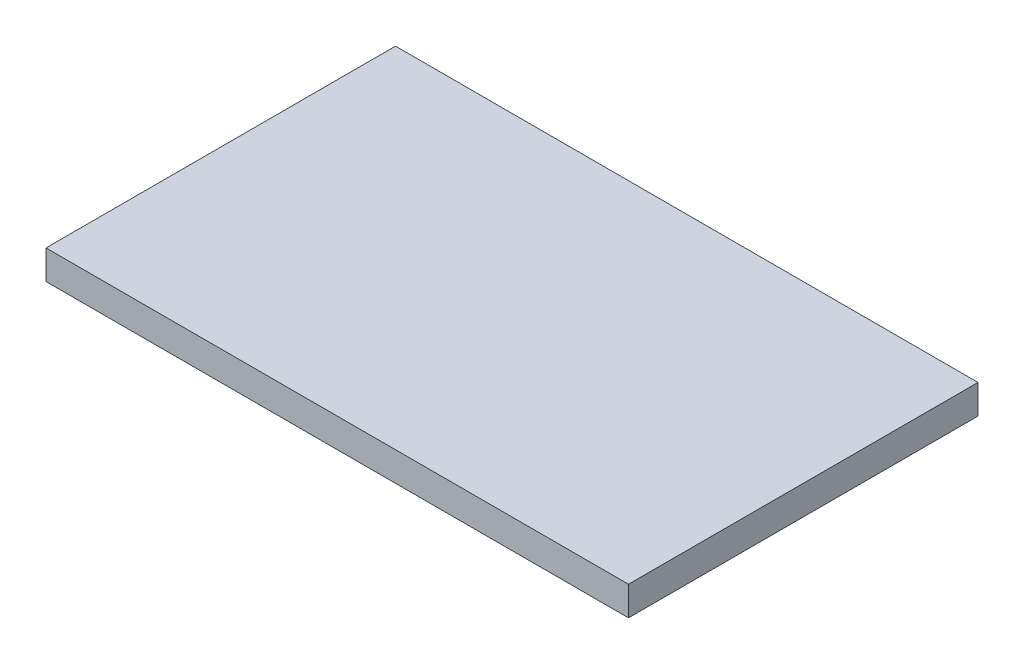
from build123d import *

# Parameters (mm, degrees)
SKETCH1_W           = 100
SKETCH1_H           = 60
BOSS_EXTRUDE1_DEPTH = 5


with BuildPart() as part:
    # Sketch1 → Boss-Extrude1 (new body)
    with BuildSketch(Plane(origin=(0, 0, 0), x_dir=(1, 0, 0), z_dir=(0, 1, 0))):
        with Locations((50, 30)):
            Rectangle(SKETCH1_W, SKETCH1_H)
    extrude(amount=BOSS_EXTRUDE1_DEPTH)


solid = part.part
